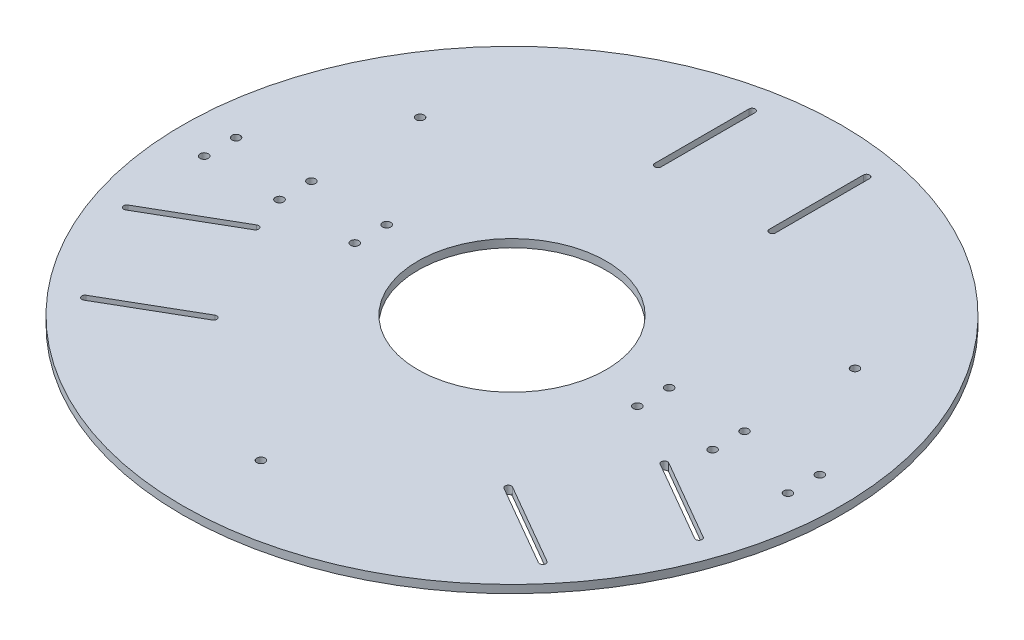
from build123d import *

# Parameters (mm, degrees)
SKETCH2_R           = 262.5
SKETCH2_R_2         = 75
SKETCH2_R_3         = 3.2639
SKETCH2_R_4         = 3.25
BOSS_EXTRUDE1_DEPTH = 6.35


with BuildPart() as part:
    # Sketch2 → Boss-Extrude1 (new body)
    with BuildSketch(Plane(origin=(0, 0, 0), x_dir=(1, 0, 0), z_dir=(0, 1, 0))):
        with Locations(Location((0, 0, 0), (0, 0, 270))):
            Circle(SKETCH2_R)
        with Locations(Location((0, 0, 0), (0, 0, 270))):
            Circle(SKETCH2_R_2, mode=Mode.SUBTRACT)
        with Locations(Location((-232.5, 12.7, 0), (0, 0, 270))):
            Circle(SKETCH2_R_3, mode=Mode.SUBTRACT)
        with Locations(Location((-172.5, 12.7, 0), (0, 0, 270))):
            Circle(SKETCH2_R_3, mode=Mode.SUBTRACT)
        with Locations(Location((-112.5, 12.7, 0), (0, 0, 270))):
            Circle(SKETCH2_R_3, mode=Mode.SUBTRACT)
        with Locations(Location((112.5, 12.7, 0), (0, 0, 270))):
            Circle(SKETCH2_R_3, mode=Mode.SUBTRACT)
        with Locations(Location((172.5, 12.7, 0), (0, 0, 270))):
            Circle(SKETCH2_R_3, mode=Mode.SUBTRACT)
        with Locations(Location((232.5, 12.7, 0), (0, 0, 270))):
            Circle(SKETCH2_R_3, mode=Mode.SUBTRACT)
        with Locations(Location((232.5, -12.7, 0), (0, 0, 270))):
            Circle(SKETCH2_R_3, mode=Mode.SUBTRACT)
        with Locations(Location((172.5, -12.7, 0), (0, 0, 270))):
            Circle(SKETCH2_R_3, mode=Mode.SUBTRACT)
        with Locations(Location((112.5, -12.7, 0), (0, 0, 270))):
            Circle(SKETCH2_R_3, mode=Mode.SUBTRACT)
        with Locations(Location((-112.5, -12.7, 0), (0, 0, 270))):
            Circle(SKETCH2_R_3, mode=Mode.SUBTRACT)
        with Locations(Location((-172.5, -12.7, 0), (0, 0, 270))):
            Circle(SKETCH2_R_3, mode=Mode.SUBTRACT)
        with Locations(Location((-232.5, -12.7, 0), (0, 0, 270))):
            Circle(SKETCH2_R_3, mode=Mode.SUBTRACT)
        with Locations(Location((-173.205080757, 100, 0), (0, 0, 270))):
            Circle(SKETCH2_R_4, mode=Mode.SUBTRACT)
        with Locations(Location((173.205080757, 100, 0), (0, 0, 270))):
            Circle(SKETCH2_R_4, mode=Mode.SUBTRACT)
        with Locations(Location((0, -200, 0), (0, 0, 270))):
            Circle(SKETCH2_R_4, mode=Mode.SUBTRACT)
        with BuildLine():
            Line((-43.05, 236.77567), (-43.05, 161.77567))
            ThreePointArc((-43.05, 161.77567), (-45.55, 159.27567), (-48.05, 161.77567))
            Line((-48.05, 161.77567), (-48.05, 236.77567))
            ThreePointArc((-48.05, 236.77567), (-45.55, 239.27567), (-43.05, 236.77567))
        make_face(mode=Mode.SUBTRACT)
        with BuildLine():
            Line((43.05, 236.77567), (43.05, 161.77567))
            ThreePointArc((43.05, 161.77567), (45.55, 159.27567), (48.05, 161.77567))
            Line((48.05, 161.77567), (48.05, 236.77567))
            ThreePointArc((48.05, 236.77567), (45.55, 239.27567), (43.05, 236.77567))
        make_face(mode=Mode.SUBTRACT)
        with BuildLine():
            Line((226.578745218, -81.105441367), (161.626839934, -43.605441367))
            ThreePointArc((161.626839934, -43.605441367), (160.711776425, -40.190377858), (164.126839934, -39.275314348))
            Line((164.126839934, -39.275314348), (229.078745218, -76.775314348))
            ThreePointArc((229.078745218, -76.775314348), (229.993808728, -80.190377858), (226.578745218, -81.105441367))
        make_face(mode=Mode.SUBTRACT)
        with BuildLine():
            Line((183.528745218, -155.670228633), (118.576839934, -118.170228633))
            ThreePointArc((118.576839934, -118.170228633), (115.161776425, -119.085292142), (116.076839934, -122.500355652))
            Line((116.076839934, -122.500355652), (181.028745218, -160.000355652))
            ThreePointArc((181.028745218, -160.000355652), (184.443808728, -159.085292142), (183.528745218, -155.670228633))
        make_face(mode=Mode.SUBTRACT)
        with BuildLine():
            Line((-183.528745218, -155.670228633), (-118.576839934, -118.170228633))
            ThreePointArc((-118.576839934, -118.170228633), (-115.161776425, -119.085292142), (-116.076839934, -122.500355652))
            Line((-116.076839934, -122.500355652), (-181.028745218, -160.000355652))
            ThreePointArc((-181.028745218, -160.000355652), (-184.443808728, -159.085292142), (-183.528745218, -155.670228633))
        make_face(mode=Mode.SUBTRACT)
        with BuildLine():
            Line((-226.578745218, -81.105441367), (-161.626839934, -43.605441367))
            ThreePointArc((-161.626839934, -43.605441367), (-160.711776425, -40.190377858), (-164.126839934, -39.275314348))
            Line((-164.126839934, -39.275314348), (-229.078745218, -76.775314348))
            ThreePointArc((-229.078745218, -76.775314348), (-229.993808728, -80.190377858), (-226.578745218, -81.105441367))
        make_face(mode=Mode.SUBTRACT)
    extrude(amount=BOSS_EXTRUDE1_DEPTH)


solid = part.part
